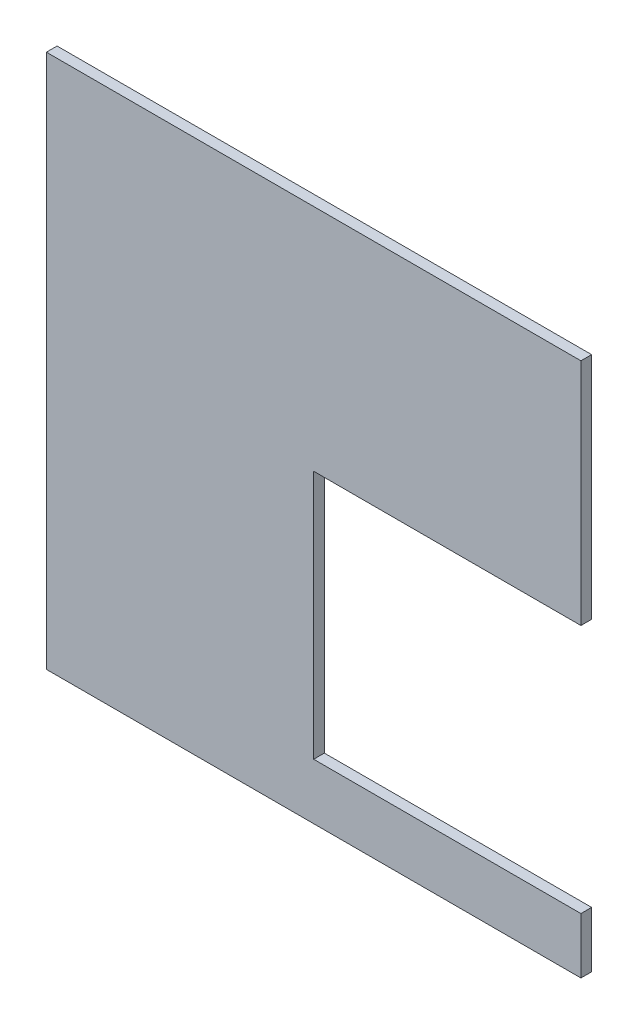
from build123d import *

# Parameters (mm, degrees)
ESQUISSE1_W             = 150
ESQUISSE1_H             = 150
BOSS_EXTRU_1_DEPTH      = 3
ESQUISSE2_W             = 75
ESQUISSE2_H             = 70
ENL_V_MAT_EXTRU_1_DEPTH = 107.108435103


with BuildPart() as part:
    # Esquisse1 → Boss.-Extru.1 (new body)
    with BuildSketch(Plane.XY):
        Rectangle(ESQUISSE1_W, ESQUISSE1_H)
    extrude(amount=BOSS_EXTRU_1_DEPTH)

    # Esquisse2 → Enlèv. mat.-Extru.1 (cut, through all)
    with BuildSketch(Plane.XY.offset(3)):
        with Locations((37.5, -24.338030686)):
            Rectangle(ESQUISSE2_W, ESQUISSE2_H)
    extrude(amount=-ENL_V_MAT_EXTRU_1_DEPTH, mode=Mode.SUBTRACT)


solid = part.part
